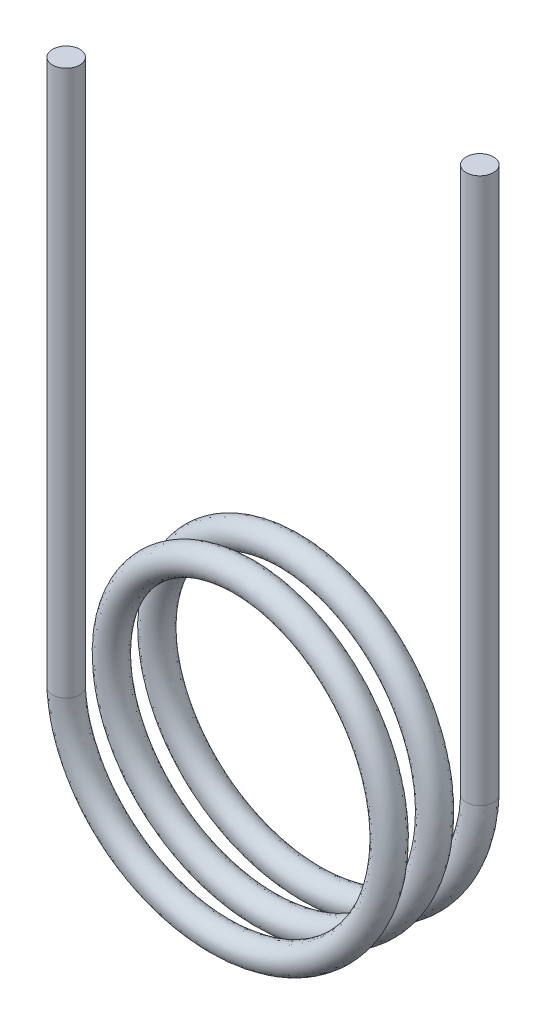
from build123d import *

# Parameters (mm, degrees)
VARREDURA1_PITCH         = 7.5
VARREDURA1_HEIGHT        = 18.75
VARREDURA1_RADIUS        = 24.75
ESBO_O2_R                = 2.25
ESBO_O2_2_R              = 2.25
RESSALTO_EXTRUS_O3_DEPTH = 90
ESBO_O3_R                = 2.25
RESSALTO_EXTRUS_O8_DEPTH = 90


with BuildPart() as part:
    # Varredura1: sweep along a helix
    with BuildLine() as varredura1_path:
        Helix(VARREDURA1_PITCH, VARREDURA1_HEIGHT, VARREDURA1_RADIUS, center=(0, 0, 0), direction=(0, 0, 1), lefthand=True)
    # Esboço2 → Varredura1 (sweep)
    with BuildSketch(Plane(origin=(0, 0, 0), x_dir=(1, 0, 0), z_dir=(0, 1, 0))):
        with Locations((24.75, 0)):
            Circle(ESBO_O2_R)
    sweep(path=varredura1_path.line, is_frenet=True)

    # Esboço2<2> → Ressalto-extrusão3 (add)
    with BuildSketch(Plane(origin=(0, 0, 0), x_dir=(1, 0, 0), z_dir=(0, 1, 0))):
        with Locations(Location((24.75, 0, 0), (0, 0, 270))):
            Circle(ESBO_O2_2_R)
    extrude(amount=RESSALTO_EXTRUS_O3_DEPTH)

    # Esboço3 → Ressalto-extrusão8 (add)
    with BuildSketch(Plane(origin=(0, 0, 0), x_dir=(1, 0, 0), z_dir=(0, 1, 0))):
        with Locations(Location((-24.75, -18.75, 0), (0, 0, 270))):
            Circle(ESBO_O3_R)
    extrude(amount=RESSALTO_EXTRUS_O8_DEPTH)


solid = part.part
